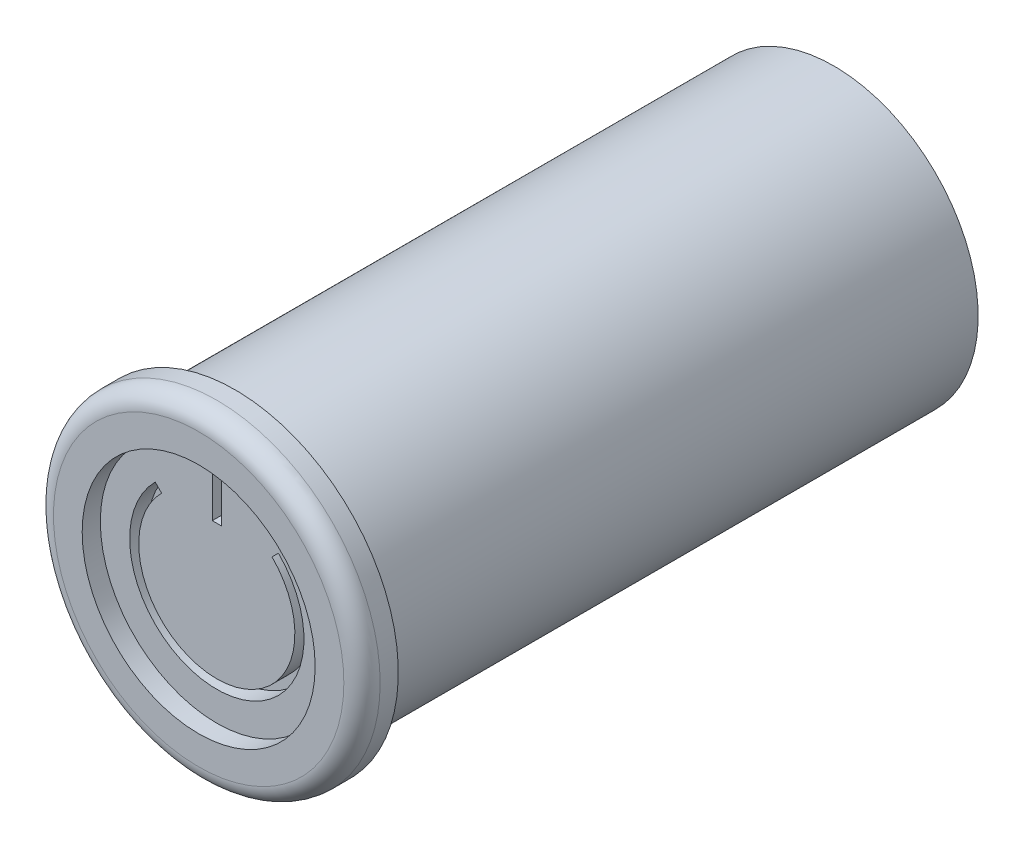
from build123d import *

# Parameters (mm, degrees)
SKETCH1_R           = 9
BOSS_EXTRUDE1_DEPTH = 35
SKETCH2_R           = 10.726971326
SKETCH2_R_2         = 7.95
CUT_EXTRUDE1_DEPTH  = 33
FILLET1_R           = 1
SKETCH3_R           = 6.418564364
CUT_EXTRUDE2_DEPTH  = 1
SKETCH4_W           = 0.5
SKETCH4_H           = 2.354367894
CUT_EXTRUDE3_DEPTH  = 1


with BuildPart() as part:
    # Sketch1 → Boss-Extrude1 (new body)
    with BuildSketch(Plane.XY):
        Circle(SKETCH1_R)
    extrude(amount=BOSS_EXTRUDE1_DEPTH)

    # Sketch2 → Cut-Extrude1 (cut)
    with BuildSketch(Plane(origin=(0, 0, 0), x_dir=(-1, 0, 0), z_dir=(0, 0, -1))):
        Circle(SKETCH2_R)
        Circle(SKETCH2_R_2, mode=Mode.SUBTRACT)
    extrude(amount=-CUT_EXTRUDE1_DEPTH, mode=Mode.SUBTRACT)

    # Fillet1
    fillet1_edges = [part.edges().sort_by_distance(p)[0] for p in [
        (-9, 0, 35),
    ]]
    fillet(fillet1_edges, radius=FILLET1_R)

    # Sketch3 → Cut-Extrude2 (cut)
    with BuildSketch(Plane.XY.offset(35)):
        Circle(SKETCH3_R)
    extrude(amount=-CUT_EXTRUDE2_DEPTH, mode=Mode.SUBTRACT)

    # Sketch4 → Cut-Extrude3 (cut)
    with BuildSketch(Plane.XY.offset(34)):
        with BuildLine():
            Line((-3.395267389, 3.395267389), (-3.041713998, 3.041713998))
            ThreePointArc((-3.041713998, 3.041713998), (0, -4.301633189), (3.041713998, 3.041713998))
            Line((3.041713998, 3.041713998), (3.395267389, 3.395267389))
            ThreePointArc((3.395267389, 3.395267389), (0, -4.801633189), (-3.395267389, 3.395267389))
        make_face()
        with Locations((0, 4.302029464)):
            Rectangle(SKETCH4_W, SKETCH4_H)
    extrude(amount=-CUT_EXTRUDE3_DEPTH, mode=Mode.SUBTRACT)


solid = part.part
